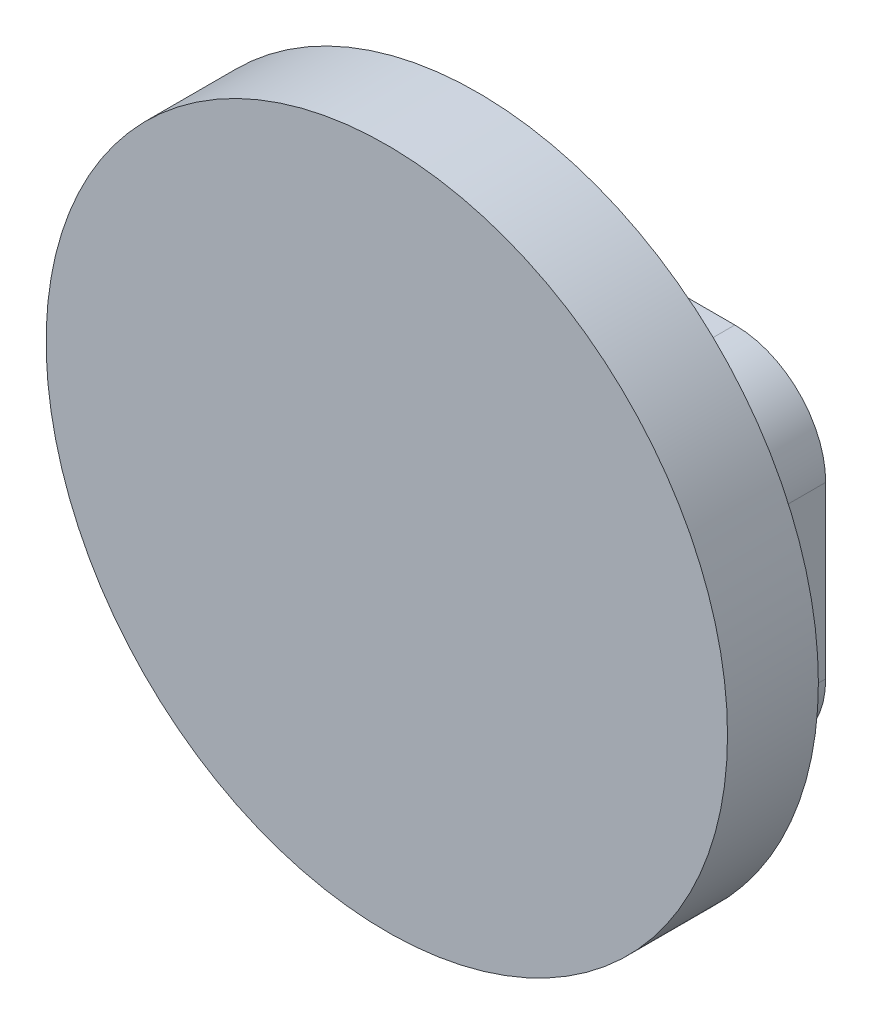
from build123d import *

# Parameters (mm, degrees)
SKETCH1_R           = 37.5
BOSS_EXTRUDE1_DEPTH = 10
BOSS_EXTRUDE2_DEPTH = 10


with BuildPart() as part:
    # Sketch1 → Boss-Extrude1 (new body)
    with BuildSketch(Plane.XY):
        with Locations((11.945516858, 0)):
            Circle(SKETCH1_R)
    extrude(amount=BOSS_EXTRUDE1_DEPTH)

    # Sketch2 → Boss-Extrude2 (add)
    with BuildSketch(Plane(origin=(0, 0, 0), x_dir=(-1, 0, 0), z_dir=(0, 0, -1))):
        with BuildLine():
            Line((-30.25, 19.484324941), (6.25, 19.484324941))
            ThreePointArc((6.25, 19.484324941), (13.321067812, 16.555392753), (16.25, 9.484324941))
            Line((16.25, 9.484324941), (16.25, -9.205373472))
            ThreePointArc((16.25, -9.205373472), (13.324868437, -16.272638614), (6.260752682, -19.205367691))
            Line((6.260752682, -19.205367691), (-30.239247318, -19.244615001))
            ThreePointArc((-30.239247318, -19.244615001), (-37.317265142, -16.319489219), (-40.25, -9.244620782))
            Line((-40.25, -9.244620782), (-40.25, 9.484324941))
            ThreePointArc((-40.25, 9.484324941), (-37.321067812, 16.555392753), (-30.25, 19.484324941))
        make_face()
        Polygon((-35.25, -14.250000016), (11.25, -14.200000018), (11.25, 14.484324941), (-35.25, 14.484324941), align=None, mode=Mode.SUBTRACT)
    extrude(amount=BOSS_EXTRUDE2_DEPTH)


solid = part.part
